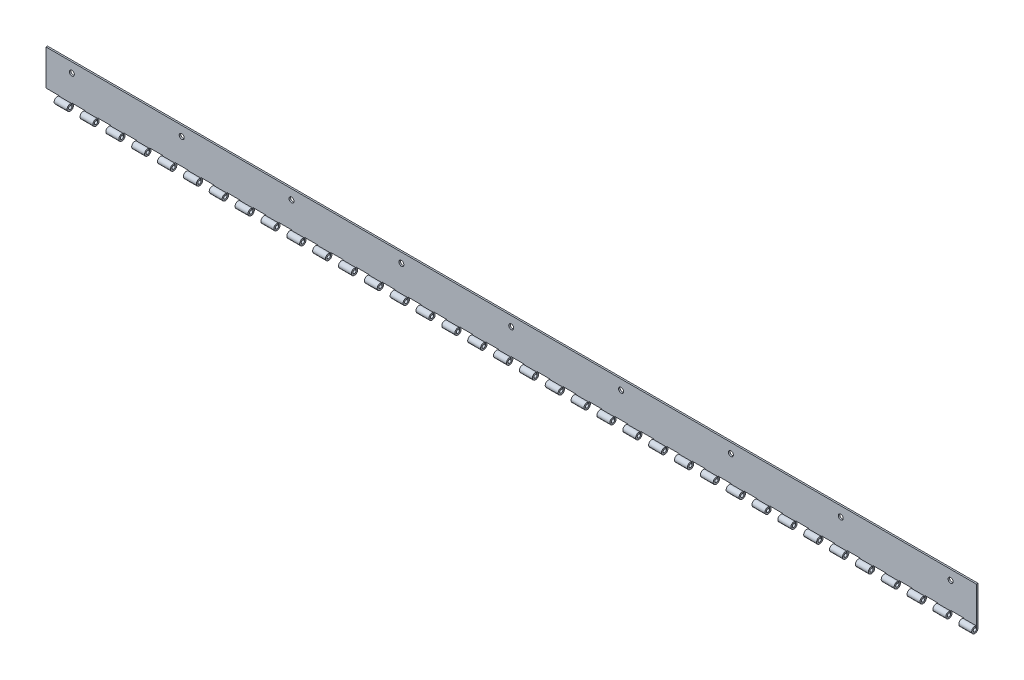
from build123d import *

# Parameters (mm, degrees)
BOSS_EXTRUDE1_DEPTH                    = 457.2
SKETCH4_W                              = 12.7
SKETCH4_H                              = 6.223
CUT_EXTRUDE1_DEPTH                     = 459.795304501
LPATTERN1_COUNT                        = 36
LPATTERN1_PITCH                        = 25.4
BOSS_EXTRUDE2_DEPTH                    = 914.4
SKETCH6_W                              = 12.7
SKETCH6_H                              = 6.223
CUT_EXTRUDE2_DEPTH                     = 459.795304501
LPATTERN2_COUNT                        = 36
LPATTERN2_PITCH                        = 25.4
SKETCH7_R                              = 1.5875
BOSS_EXTRUDE3_DEPTH                    = 914.4
CHAMFER1_SIZE                          = 0.3175
SKETCH9_W                              = 2.45745
SKETCH9_H                              = 1.524
F_10_0_1935_DIAMETER_HOLE1_AT_2_COUNT  = 2
F_10_0_1935_DIAMETER_HOLE1_AT_2_PITCH  = 57.15
F_10_0_1935_DIAMETER_HOLE1_AT_3_COUNT  = 2
F_10_0_1935_DIAMETER_HOLE1_AT_3_PITCH  = 107.95
F_10_0_1935_DIAMETER_HOLE1_AT_4_COUNT  = 2
F_10_0_1935_DIAMETER_HOLE1_AT_4_PITCH  = 122.144688792
F_10_0_1935_DIAMETER_HOLE1_AT_5_COUNT  = 2
F_10_0_1935_DIAMETER_HOLE1_AT_5_PITCH  = 215.9
F_10_0_1935_DIAMETER_HOLE1_AT_6_COUNT  = 2
F_10_0_1935_DIAMETER_HOLE1_AT_6_PITCH  = 223.335918517
F_10_0_1935_DIAMETER_HOLE1_AT_7_COUNT  = 2
F_10_0_1935_DIAMETER_HOLE1_AT_7_PITCH  = 323.85
F_10_0_1935_DIAMETER_HOLE1_AT_8_COUNT  = 2
F_10_0_1935_DIAMETER_HOLE1_AT_8_PITCH  = 328.853987356
F_10_0_1935_DIAMETER_HOLE1_AT_9_COUNT  = 2
F_10_0_1935_DIAMETER_HOLE1_AT_9_PITCH  = 431.8
F_10_0_1935_DIAMETER_HOLE1_AT_10_COUNT = 2
F_10_0_1935_DIAMETER_HOLE1_AT_10_PITCH = 435.565566247
F_10_0_1935_DIAMETER_HOLE1_AT_11_COUNT = 2
F_10_0_1935_DIAMETER_HOLE1_AT_11_PITCH = 539.75
F_10_0_1935_DIAMETER_HOLE1_AT_12_COUNT = 2
F_10_0_1935_DIAMETER_HOLE1_AT_12_PITCH = 542.767155417
F_10_0_1935_DIAMETER_HOLE1_AT_13_COUNT = 2
F_10_0_1935_DIAMETER_HOLE1_AT_13_PITCH = 647.7
F_10_0_1935_DIAMETER_HOLE1_AT_14_COUNT = 2
F_10_0_1935_DIAMETER_HOLE1_AT_14_PITCH = 650.21643512
F_10_0_1935_DIAMETER_HOLE1_AT_15_COUNT = 2
F_10_0_1935_DIAMETER_HOLE1_AT_15_PITCH = 755.65
F_10_0_1935_DIAMETER_HOLE1_AT_16_COUNT = 2
F_10_0_1935_DIAMETER_HOLE1_AT_16_PITCH = 757.808052874
F_10_0_1935_DIAMETER_HOLE1_AT_17_COUNT = 2
F_10_0_1935_DIAMETER_HOLE1_AT_17_PITCH = 863.6
F_10_0_1935_DIAMETER_HOLE1_AT_18_COUNT = 2
F_10_0_1935_DIAMETER_HOLE1_AT_18_PITCH = 865.48892685


with BuildPart() as part:
    # Sketch3 → Boss-Extrude1 (new, symmetric)
    with BuildSketch(Plane(origin=(0, 0, 0), x_dir=(0, 0, -1), z_dir=(1, 0, 0))):
        with BuildLine():
            Line((0.670906491, -1.438763612), (1.314976721, -2.819976679))
            ThreePointArc((1.314976721, -2.819976679), (-2.624212484, 1.671807731), (3.1115, 0))
            Line((3.1115, 0), (3.1115, -38.1))
            Line((3.1115, -38.1), (1.5875, -38.1))
            Line((1.5875, -38.1), (1.5875, -2.676056053))
            Line((1.5875, -2.676056053), (1.5875, 0))
            ThreePointArc((1.5875, 0), (-1.33888392, 0.852963128), (0.670906491, -1.438763612))
        make_face()
    extrude(amount=BOSS_EXTRUDE1_DEPTH, both=True)

    # Sketch4 → Cut-Extrude1 (cut, symmetric)
    with BuildSketch(Plane.XY):
        with Locations((450.85, 0)):
            Rectangle(SKETCH4_W, SKETCH4_H)
    cut_extrude1 = extrude(amount=CUT_EXTRUDE1_DEPTH, both=True, mode=Mode.SUBTRACT)

    # LPattern1: Cut-Extrude1 ×36
    with Locations(*[(-i * LPATTERN1_PITCH, 0, 0) for i in range(1, LPATTERN1_COUNT)]):
        add(cut_extrude1, mode=Mode.SUBTRACT)

    # Sketch9 → #10 (0.1935) Diameter Hole1 (revolve, cut)
    with BuildSketch(Plane(origin=(-431.8, -28.575, -1.5875), x_dir=(0, -1, 0), z_dir=(1, 0, 0))):
        with Locations((1.228725, 0.762)):
            Rectangle(SKETCH9_W, SKETCH9_H)
    f_10_0_1935_diameter_hole1 = revolve(axis=Axis((-431.8, -28.575, 4.7625), (0, 0, -1)), mode=Mode.SUBTRACT)

    # #10 (0.1935) Diameter Hole1 at 3: #10 (0.1935) Diameter Hole1 ×2
    with Locations(*[(i * F_10_0_1935_DIAMETER_HOLE1_AT_3_PITCH, 0, 0) for i in range(1, F_10_0_1935_DIAMETER_HOLE1_AT_3_COUNT)]):
        add(f_10_0_1935_diameter_hole1, mode=Mode.SUBTRACT)

    # #10 (0.1935) Diameter Hole1 at 5: #10 (0.1935) Diameter Hole1 ×2
    with Locations(*[(i * F_10_0_1935_DIAMETER_HOLE1_AT_5_PITCH, 0, 0) for i in range(1, F_10_0_1935_DIAMETER_HOLE1_AT_5_COUNT)]):
        add(f_10_0_1935_diameter_hole1, mode=Mode.SUBTRACT)

    # #10 (0.1935) Diameter Hole1 at 7: #10 (0.1935) Diameter Hole1 ×2
    with Locations(*[(i * F_10_0_1935_DIAMETER_HOLE1_AT_7_PITCH, 0, 0) for i in range(1, F_10_0_1935_DIAMETER_HOLE1_AT_7_COUNT)]):
        add(f_10_0_1935_diameter_hole1, mode=Mode.SUBTRACT)

    # #10 (0.1935) Diameter Hole1 at 9: #10 (0.1935) Diameter Hole1 ×2
    with Locations(*[(i * F_10_0_1935_DIAMETER_HOLE1_AT_9_PITCH, 0, 0) for i in range(1, F_10_0_1935_DIAMETER_HOLE1_AT_9_COUNT)]):
        add(f_10_0_1935_diameter_hole1, mode=Mode.SUBTRACT)

    # #10 (0.1935) Diameter Hole1 at 11: #10 (0.1935) Diameter Hole1 ×2
    with Locations(*[(i * F_10_0_1935_DIAMETER_HOLE1_AT_11_PITCH, 0, 0) for i in range(1, F_10_0_1935_DIAMETER_HOLE1_AT_11_COUNT)]):
        add(f_10_0_1935_diameter_hole1, mode=Mode.SUBTRACT)

    # #10 (0.1935) Diameter Hole1 at 13: #10 (0.1935) Diameter Hole1 ×2
    with Locations(*[(i * F_10_0_1935_DIAMETER_HOLE1_AT_13_PITCH, 0, 0) for i in range(1, F_10_0_1935_DIAMETER_HOLE1_AT_13_COUNT)]):
        add(f_10_0_1935_diameter_hole1, mode=Mode.SUBTRACT)

    # #10 (0.1935) Diameter Hole1 at 15: #10 (0.1935) Diameter Hole1 ×2
    with Locations(*[(i * F_10_0_1935_DIAMETER_HOLE1_AT_15_PITCH, 0, 0) for i in range(1, F_10_0_1935_DIAMETER_HOLE1_AT_15_COUNT)]):
        add(f_10_0_1935_diameter_hole1, mode=Mode.SUBTRACT)

    # #10 (0.1935) Diameter Hole1 at 17: #10 (0.1935) Diameter Hole1 ×2
    with Locations(*[(i * F_10_0_1935_DIAMETER_HOLE1_AT_17_PITCH, 0, 0) for i in range(1, F_10_0_1935_DIAMETER_HOLE1_AT_17_COUNT)]):
        add(f_10_0_1935_diameter_hole1, mode=Mode.SUBTRACT)


with BuildPart() as body_2:
    # Sketch5 → Boss-Extrude2 (new body)
    with BuildSketch(Plane(origin=(457.2, 0, 0), x_dir=(0, 0, -1), z_dir=(1, 0, 0))):
        with BuildLine():
            Line((1.5875, 38.1), (1.5875, 2.676056053))
            Line((1.5875, 2.676056053), (1.5875, 0))
            ThreePointArc((1.5875, 0), (-1.33888392, -0.852963128), (0.670906491, 1.438763612))
            Line((0.670906491, 1.438763612), (1.314976721, 2.819976679))
            ThreePointArc((1.314976721, 2.819976679), (-2.624212484, -1.671807731), (3.1115, 0))
            Line((3.1115, 0), (3.1115, 38.1))
            Line((3.1115, 38.1), (1.5875, 38.1))
        make_face()
    extrude(amount=-BOSS_EXTRUDE2_DEPTH)

    # Sketch6 → Cut-Extrude2 (cut, symmetric)
    with BuildSketch(Plane.XY):
        with Locations((438.15, 0)):
            Rectangle(SKETCH6_W, SKETCH6_H)
    cut_extrude2 = extrude(amount=CUT_EXTRUDE2_DEPTH, both=True, mode=Mode.SUBTRACT)

    # LPattern2: Cut-Extrude2 ×36
    with Locations(*[(-i * LPATTERN2_PITCH, 0, 0) for i in range(1, LPATTERN2_COUNT)]):
        add(cut_extrude2, mode=Mode.SUBTRACT)

    # #10 (0.1935) Diameter Hole1 at 2: #10 (0.1935) Diameter Hole1 ×2
    with Locations(*[(0, i * F_10_0_1935_DIAMETER_HOLE1_AT_2_PITCH, 0) for i in range(1, F_10_0_1935_DIAMETER_HOLE1_AT_2_COUNT)]):
        add(f_10_0_1935_diameter_hole1, mode=Mode.SUBTRACT)

    # #10 (0.1935) Diameter Hole1 at 4: #10 (0.1935) Diameter Hole1 ×2
    with Locations(*[Vector(0.8837879163470618, 0.46788772041903287, 0) * (i * F_10_0_1935_DIAMETER_HOLE1_AT_4_PITCH) for i in range(1, F_10_0_1935_DIAMETER_HOLE1_AT_4_COUNT)]):
        add(f_10_0_1935_diameter_hole1, mode=Mode.SUBTRACT)

    # #10 (0.1935) Diameter Hole1 at 6: #10 (0.1935) Diameter Hole1 ×2
    with Locations(*[Vector(0.9667052278615119, 0.2558925603162827, 0) * (i * F_10_0_1935_DIAMETER_HOLE1_AT_6_PITCH) for i in range(1, F_10_0_1935_DIAMETER_HOLE1_AT_6_COUNT)]):
        add(f_10_0_1935_diameter_hole1, mode=Mode.SUBTRACT)

    # #10 (0.1935) Diameter Hole1 at 8: #10 (0.1935) Diameter Hole1 ×2
    with Locations(*[Vector(0.9847835588179368, 0.17378533390904774, 0) * (i * F_10_0_1935_DIAMETER_HOLE1_AT_8_PITCH) for i in range(1, F_10_0_1935_DIAMETER_HOLE1_AT_8_COUNT)]):
        add(f_10_0_1935_diameter_hole1, mode=Mode.SUBTRACT)

    # #10 (0.1935) Diameter Hole1 at 10: #10 (0.1935) Diameter Hole1 ×2
    with Locations(*[Vector(0.9913547659899606, 0.13120871902808307, 0) * (i * F_10_0_1935_DIAMETER_HOLE1_AT_10_PITCH) for i in range(1, F_10_0_1935_DIAMETER_HOLE1_AT_10_COUNT)]):
        add(f_10_0_1935_diameter_hole1, mode=Mode.SUBTRACT)

    # #10 (0.1935) Diameter Hole1 at 12: #10 (0.1935) Diameter Hole1 ×2
    with Locations(*[Vector(0.9944411606572344, 0.1052937699519425, 0) * (i * F_10_0_1935_DIAMETER_HOLE1_AT_12_PITCH) for i in range(1, F_10_0_1935_DIAMETER_HOLE1_AT_12_COUNT)]):
        add(f_10_0_1935_diameter_hole1, mode=Mode.SUBTRACT)

    # #10 (0.1935) Diameter Hole1 at 14: #10 (0.1935) Diameter Hole1 ×2
    with Locations(*[Vector(0.996129850025381, 0.08789381029635718, 0) * (i * F_10_0_1935_DIAMETER_HOLE1_AT_14_PITCH) for i in range(1, F_10_0_1935_DIAMETER_HOLE1_AT_14_COUNT)]):
        add(f_10_0_1935_diameter_hole1, mode=Mode.SUBTRACT)

    # #10 (0.1935) Diameter Hole1 at 16: #10 (0.1935) Diameter Hole1 ×2
    with Locations(*[Vector(0.9971522434139278, 0.07541487555231391, 0) * (i * F_10_0_1935_DIAMETER_HOLE1_AT_16_PITCH) for i in range(1, F_10_0_1935_DIAMETER_HOLE1_AT_16_COUNT)]):
        add(f_10_0_1935_diameter_hole1, mode=Mode.SUBTRACT)

    # #10 (0.1935) Diameter Hole1 at 18: #10 (0.1935) Diameter Hole1 ×2
    with Locations(*[Vector(0.997817503157556, 0.0660320406501324, 0) * (i * F_10_0_1935_DIAMETER_HOLE1_AT_18_PITCH) for i in range(1, F_10_0_1935_DIAMETER_HOLE1_AT_18_COUNT)]):
        add(f_10_0_1935_diameter_hole1, mode=Mode.SUBTRACT)


with BuildPart() as body_3:
    # Sketch7 → Boss-Extrude3 (new body)
    with BuildSketch(Plane(origin=(457.2, 0, 0), x_dir=(0, 0, -1), z_dir=(1, 0, 0))):
        Circle(SKETCH7_R)
    extrude(amount=-BOSS_EXTRUDE3_DEPTH)

    # Chamfer1
    chamfer1_edges = [body_3.edges().sort_by_distance(p)[0] for p in [
        (457.2, 0, 1.5875),
        (-457.2, 0, 1.5875),
    ]]
    chamfer(chamfer1_edges, length=CHAMFER1_SIZE)


solid = body_2.part
